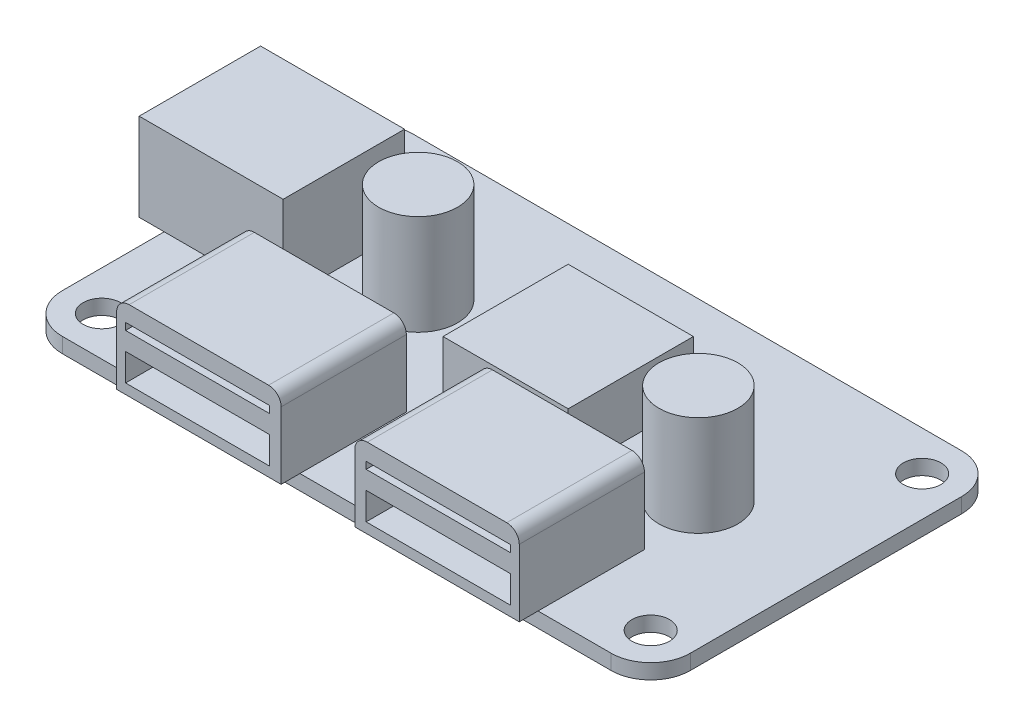
from build123d import *

# Parameters (mm, degrees)
SKETCH_1_R          = 1.5
EXTRUDE_1_DEPTH     = 1.2
SKETCH_2_W          = 13.14
SKETCH_2_H          = 10
EXTRUDE_3_DEPTH     = 6.36
EXTRUDE_3_2_DEPTH   = 6.36
SKETCH_2_4_W        = 11.5
SKETCH_2_4_H        = 9.7
EXTRUDE_4_DEPTH     = 7
SKETCH_2_5_R        = 3.15
EXTRUDE_5_DEPTH     = 8
SKETCH_2_6_W        = 10
SKETCH_2_6_H        = 10
EXTRUDE_6_DEPTH     = 4.5
SKETCH_3_R          = 3
SKETCH_3_R_2        = 0.5
CUT_EXTRUDE_2_DEPTH = 9.2
FILLET_1_R          = 1
FILLET_2_R          = 1
SKETCH_4_W          = 11.514335883
SKETCH_4_H          = 2.179898541
SKETCH_4_H_2        = 0.558948344
CUT_EXTRUDE_3_DEPTH = 7.2


with BuildPart() as part:
    # 草图1 → 凸台-拉伸1 (new body)
    with BuildSketch(Plane(origin=(0, 0, 0), x_dir=(1, 0, 0), z_dir=(0, 1, 0))):
        with BuildLine():
            Line((-21.92, 14), (21.92, 14))
            ThreePointArc((21.92, 14), (24.154457429, 13.074457429), (25.08, 10.84))
            Line((25.08, 10.84), (25.08, -10.84))
            ThreePointArc((25.08, -10.84), (24.154457429, -13.074457429), (21.92, -14))
            Line((21.92, -14), (-21.92, -14))
            ThreePointArc((-21.92, -14), (-24.154457429, -13.074457429), (-25.08, -10.84))
            Line((-25.08, -10.84), (-25.08, 10.84))
            ThreePointArc((-25.08, 10.84), (-24.154457429, 13.074457429), (-21.92, 14))
        make_face()
        with Locations((-21.92, 10.84)):
            Circle(SKETCH_1_R, mode=Mode.SUBTRACT)
        with Locations((21.92, 10.84)):
            Circle(SKETCH_1_R, mode=Mode.SUBTRACT)
        with Locations((21.92, -10.84)):
            Circle(SKETCH_1_R, mode=Mode.SUBTRACT)
        with Locations((-21.92, -10.84)):
            Circle(SKETCH_1_R, mode=Mode.SUBTRACT)
    extrude(amount=EXTRUDE_1_DEPTH)

    # 草图2<4> → 凸台-拉伸4 (add)
    with BuildSketch(Plane(origin=(0, 1.2, 0), x_dir=(1, 0, 0), z_dir=(0, 1, 0))):
        with Locations((-21.33, 2.15)):
            Rectangle(SKETCH_2_4_W, SKETCH_2_4_H)
    extrude(amount=EXTRUDE_4_DEPTH)

    # 草图2<5> → 凸台-拉伸5 (add)
    with BuildSketch(Plane(origin=(0, 1.2, 0), x_dir=(1, 0, 0), z_dir=(0, 1, 0))):
        with Locations((-10.212809233, 2.714457191)):
            Circle(SKETCH_2_5_R)
        with Locations((14.889200829, 0)):
            Circle(SKETCH_2_5_R)
    extrude(amount=EXTRUDE_5_DEPTH)

    # 草图2<6> → 凸台-拉伸6 (add)
    with BuildSketch(Plane(origin=(0, 1.2, 0), x_dir=(1, 0, 0), z_dir=(0, 1, 0))):
        with Locations((2.796183271, 1.692077629)):
            Rectangle(SKETCH_2_6_W, SKETCH_2_6_H)
    extrude(amount=EXTRUDE_6_DEPTH)

    # 草图3 → 切除-拉伸2 (cut)
    with BuildSketch(Plane.ZY.offset(27.08)):
        with Locations((-0.8, 4.7)):
            Circle(SKETCH_3_R)
        with Locations((-0.8, 4.7)):
            Circle(SKETCH_3_R_2, mode=Mode.SUBTRACT)
    extrude(amount=-CUT_EXTRUDE_2_DEPTH, mode=Mode.SUBTRACT)


with BuildPart() as body_2:
    # 草图2 → 凸台-拉伸3 (new body)
    with BuildSketch(Plane(origin=(0, 1.2, 0), x_dir=(1, 0, 0), z_dir=(0, 1, 0))):
        with Locations((-9.51, -10.5)):
            Rectangle(SKETCH_2_W, SKETCH_2_H)
    extrude(amount=EXTRUDE_3_DEPTH)

    # 圆角1
    fillet_1_edges = [body_2.edges().sort_by_distance(p)[0] for p in [
        (-2.94, 7.56, 10.5),
        (-16.08, 7.56, 10.5),
    ]]
    fillet(fillet_1_edges, radius=FILLET_1_R)


with BuildPart() as body_3:
    # 草图2 → Extrude 3 2 (new body)
    with BuildSketch(Plane(origin=(0, 1.2, 0), x_dir=(1, 0, 0), z_dir=(0, 1, 0))):
        with Locations((9.51, -10.5)):
            Rectangle(SKETCH_2_W, SKETCH_2_H)
    extrude(amount=EXTRUDE_3_2_DEPTH)

    # 圆角2
    fillet_2_edges = [body_3.edges().sort_by_distance(p)[0] for p in [
        (16.08, 7.56, 10.5),
        (2.94, 7.56, 10.5),
    ]]
    fillet(fillet_2_edges, radius=FILLET_2_R)


with BuildPart() as cut_extrude_3_tool:
    # 草图4 → 切除-拉伸3 (new body)
    with BuildSketch(Plane.XY.offset(15.5)):
        with Locations((-9.607804494, 3.090839471)):
            Rectangle(SKETCH_4_W, SKETCH_4_H)
        with Locations((-9.607804494, 5.913528608)):
            Rectangle(SKETCH_4_W, SKETCH_4_H_2)
        with Locations((9.607804494, 5.913528608)):
            Rectangle(SKETCH_4_W, SKETCH_4_H_2)
        with Locations((9.607804494, 3.090839471)):
            Rectangle(SKETCH_4_W, SKETCH_4_H)
    extrude(amount=-CUT_EXTRUDE_3_DEPTH)


with BuildPart() as body_2_1:
    add(body_2.part)

    # 切除-拉伸3: cut by cut_extrude_3_tool
    add(cut_extrude_3_tool.part, mode=Mode.SUBTRACT)


with BuildPart() as body_3_1:
    add(body_3.part)

    # 切除-拉伸3: cut by cut_extrude_3_tool
    add(cut_extrude_3_tool.part, mode=Mode.SUBTRACT)


solid = Compound([part.part, body_2_1.part, body_3_1.part])
